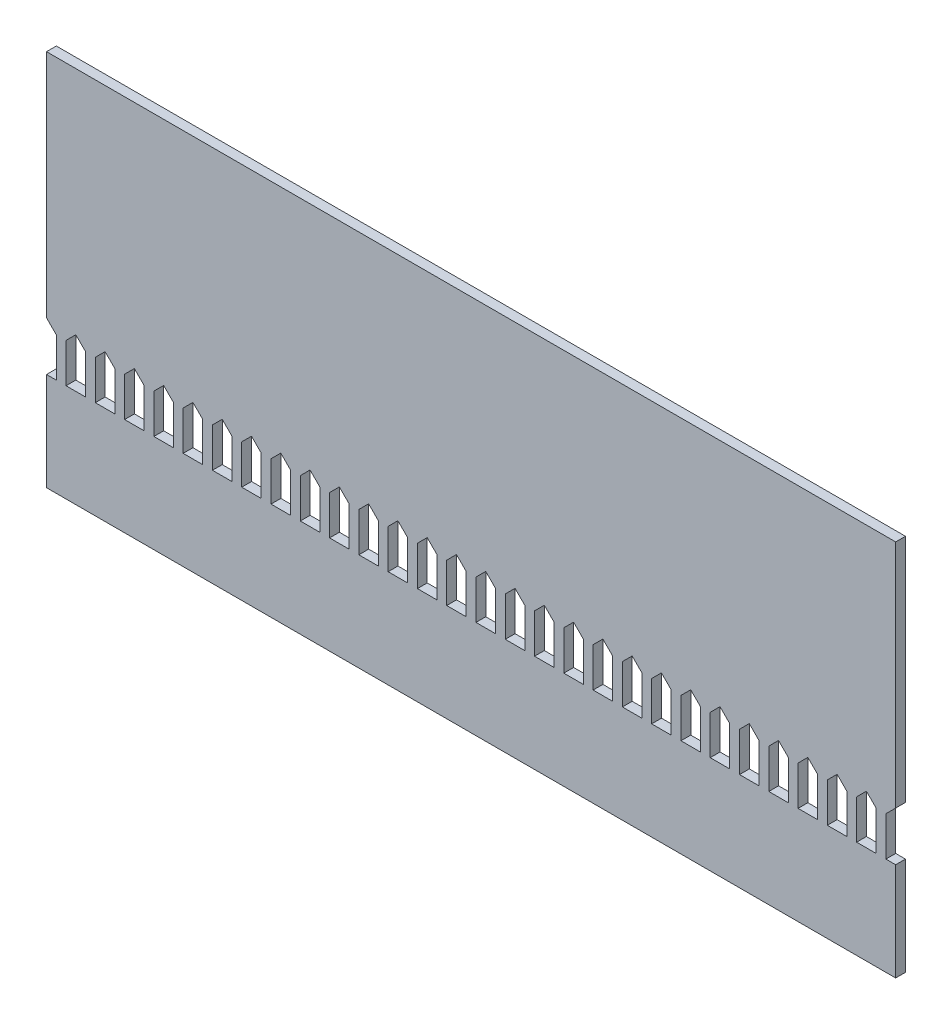
from build123d import *

# Parameters (mm, degrees)
BOSS_EXTRUDE1_DEPTH = 2


with BuildPart() as part:
    # Sketch1 → Boss-Extrude1 (new body)
    with BuildSketch(Plane(origin=(0, 0, 0), x_dir=(1, 0, 0), z_dir=(0, 0, -1))):
        Polygon((1.99, 1.99), (0, 0), (0, -47), (173.13, -47), (173.13, 0), (171.14, 1.99), (171.14, 10), (173.13, 10), (173.13, 30), (0, 30), (0, 10), (1.99, 10), align=None)
        Polygon((7.96, 1.99), (5.97, 0), (3.98, 1.99), (3.98, 10), (7.96, 10), align=None, mode=Mode.SUBTRACT)
        Polygon((13.93, 1.99), (11.94, 0), (9.95, 1.99), (9.95, 10), (13.93, 10), align=None, mode=Mode.SUBTRACT)
        Polygon((19.9, 1.99), (17.91, 0), (15.92, 1.99), (15.92, 10), (19.9, 10), align=None, mode=Mode.SUBTRACT)
        Polygon((25.87, 1.99), (23.88, 0), (21.89, 1.99), (21.89, 10), (25.87, 10), align=None, mode=Mode.SUBTRACT)
        Polygon((31.84, 1.99), (29.85, 0), (27.86, 1.99), (27.86, 10), (31.84, 10), align=None, mode=Mode.SUBTRACT)
        Polygon((37.81, 1.99), (35.82, 0), (33.83, 1.99), (33.83, 10), (37.81, 10), align=None, mode=Mode.SUBTRACT)
        Polygon((43.78, 1.99), (41.79, 0), (39.8, 1.99), (39.8, 10), (43.78, 10), align=None, mode=Mode.SUBTRACT)
        Polygon((49.75, 1.99), (47.76, 0), (45.77, 1.99), (45.77, 10), (49.75, 10), align=None, mode=Mode.SUBTRACT)
        Polygon((55.72, 1.99), (53.73, 0), (51.74, 1.99), (51.74, 10), (55.72, 10), align=None, mode=Mode.SUBTRACT)
        Polygon((61.69, 1.99), (59.7, 0), (57.71, 1.99), (57.71, 10), (61.69, 10), align=None, mode=Mode.SUBTRACT)
        Polygon((67.66, 1.99), (65.67, 0), (63.68, 1.99), (63.68, 10), (67.66, 10), align=None, mode=Mode.SUBTRACT)
        Polygon((73.63, 1.99), (71.64, 0), (69.65, 1.99), (69.65, 10), (73.63, 10), align=None, mode=Mode.SUBTRACT)
        Polygon((79.6, 1.99), (77.61, 0), (75.62, 1.99), (75.62, 10), (79.6, 10), align=None, mode=Mode.SUBTRACT)
        Polygon((85.57, 1.99), (83.58, 0), (81.59, 1.99), (81.59, 10), (85.57, 10), align=None, mode=Mode.SUBTRACT)
        Polygon((91.54, 1.99), (89.55, 0), (87.56, 1.99), (87.56, 10), (91.54, 10), align=None, mode=Mode.SUBTRACT)
        Polygon((97.51, 1.99), (95.52, 0), (93.53, 1.99), (93.53, 10), (97.51, 10), align=None, mode=Mode.SUBTRACT)
        Polygon((103.48, 1.99), (101.49, 0), (99.5, 1.99), (99.5, 10), (103.48, 10), align=None, mode=Mode.SUBTRACT)
        Polygon((109.45, 1.99), (107.46, 0), (105.47, 1.99), (105.47, 10), (109.45, 10), align=None, mode=Mode.SUBTRACT)
        Polygon((115.42, 1.99), (113.43, 0), (111.44, 1.99), (111.44, 10), (115.42, 10), align=None, mode=Mode.SUBTRACT)
        Polygon((121.39, 1.99), (119.4, 0), (117.41, 1.99), (117.41, 10), (121.39, 10), align=None, mode=Mode.SUBTRACT)
        Polygon((127.36, 1.99), (125.37, 0), (123.38, 1.99), (123.38, 10), (127.36, 10), align=None, mode=Mode.SUBTRACT)
        Polygon((133.33, 1.99), (131.34, 0), (129.35, 1.99), (129.35, 10), (133.33, 10), align=None, mode=Mode.SUBTRACT)
        Polygon((139.3, 1.99), (137.31, 0), (135.32, 1.99), (135.32, 10), (139.3, 10), align=None, mode=Mode.SUBTRACT)
        Polygon((145.27, 1.99), (143.28, 0), (141.29, 1.99), (141.29, 10), (145.27, 10), align=None, mode=Mode.SUBTRACT)
        Polygon((151.24, 1.99), (149.25, 0), (147.26, 1.99), (147.26, 10), (151.24, 10), align=None, mode=Mode.SUBTRACT)
        Polygon((157.21, 1.99), (155.22, 0), (153.23, 1.99), (153.23, 10), (157.21, 10), align=None, mode=Mode.SUBTRACT)
        Polygon((163.18, 1.99), (161.19, 0), (159.2, 1.99), (159.2, 10), (163.18, 10), align=None, mode=Mode.SUBTRACT)
        Polygon((169.15, 1.99), (167.16, 0), (165.17, 1.99), (165.17, 10), (169.15, 10), align=None, mode=Mode.SUBTRACT)
    extrude(amount=BOSS_EXTRUDE1_DEPTH)


solid = part.part
